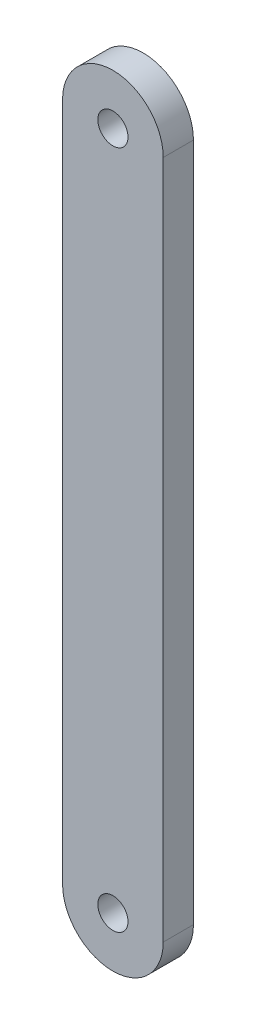
from build123d import *

# Parameters (mm, degrees)
SKETCH1_R           = 5
SKETCH1_R_2         = 1.5
BOSS_EXTRUDE1_DEPTH = 3


with BuildPart() as part:
    # Sketch1 → Boss-Extrude1 (new body)
    # profile 1 of 3: a face of its own
    with BuildSketch(Plane.XY):
        with BuildLine():
            Line((-5, 67.5), (-5, 0))
            ThreePointArc((-5, 0), (0, 5), (5, 0))
            Line((5, 0), (5, 67.5))
            ThreePointArc((5, 67.5), (0, 62.5), (-5, 67.5))
        make_face()
    # profile 2 of 3: a face of its own
    with BuildSketch(Plane.XY):
        with Locations((0, 67.5)):
            Circle(SKETCH1_R)
        with Locations((0, 67.5)):
            Circle(SKETCH1_R_2, mode=Mode.SUBTRACT)
    # profile 3 of 3: a face of its own
    with BuildSketch(Plane.XY):
        Circle(SKETCH1_R)
        Circle(SKETCH1_R_2, mode=Mode.SUBTRACT)
    extrude(amount=BOSS_EXTRUDE1_DEPTH)


solid = part.part
